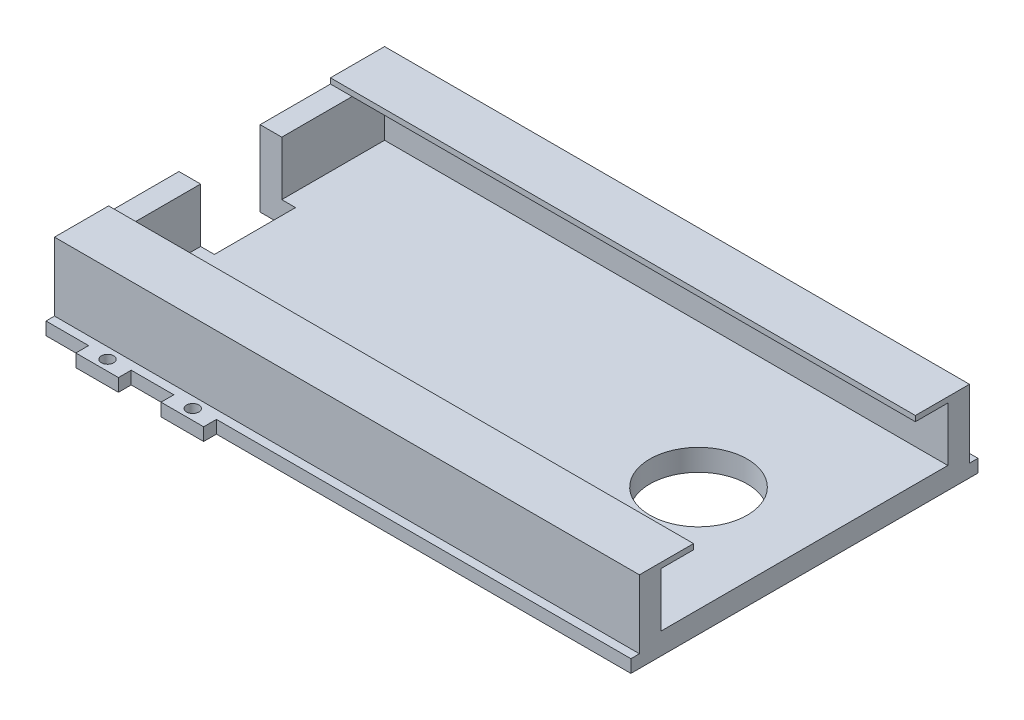
from build123d import *

# Parameters (mm, degrees)
SKETCH1_W           = 137.287
SKETCH1_H           = 77.47
BOSS_EXTRUDE1_DEPTH = 17.78
SKETCH2_W           = 132.207
SKETCH2_H           = 67.31
CUT_EXTRUDE1_DEPTH  = 12.7
SKETCH4_R           = 11.43
CUT_EXTRUDE2_DEPTH  = 80.834956737
SKETCH5_W           = 137.287
SKETCH5_H           = 12.7
BOSS_EXTRUDE2_DEPTH = 1.27
SKETCH6_W           = 8.314266468
SKETCH6_H           = 19.05
CUT_EXTRUDE3_DEPTH  = 81.798878193
SKETCH9_W           = 137.287
SKETCH9_H           = 2
SKETCH9_W_2         = 10
SKETCH9_H_2         = 3
BOSS_EXTRUDE4_DEPTH = 3
SKETCH10_R          = 1.44
CUT_EXTRUDE4_DEPTH  = 84.591762855


with BuildPart() as part:
    # Sketch1 → Boss-Extrude1 (new body)
    with BuildSketch(Plane(origin=(0, 0, 0), x_dir=(1, 0, 0), z_dir=(0, 1, 0))):
        Rectangle(SKETCH1_W, SKETCH1_H)
    extrude(amount=BOSS_EXTRUDE1_DEPTH)

    # Sketch2 → Cut-Extrude1 (cut)
    with BuildSketch(Plane(origin=(0, 17.78, 0), x_dir=(1, 0, 0), z_dir=(0, 1, 0))):
        with Locations((2.54, 0)):
            Rectangle(SKETCH2_W, SKETCH2_H)
    extrude(amount=-CUT_EXTRUDE1_DEPTH, mode=Mode.SUBTRACT)

    # Sketch4 → Cut-Extrude2 (cut, through all)
    with BuildSketch(Plane(origin=(0, 5.08, 0), x_dir=(1, 0, 0), z_dir=(0, 1, 0))):
        with Locations(Location((43.7769, 0, 0), (0, 0, 270))):
            Circle(SKETCH4_R)
    extrude(amount=-CUT_EXTRUDE2_DEPTH, mode=Mode.SUBTRACT)

    # Sketch5 → Boss-Extrude2 (add)
    with BuildSketch(Plane(origin=(0, 17.78, 0), x_dir=(1, 0, 0), z_dir=(0, 1, 0))):
        with Locations((0, 32.385)):
            Rectangle(SKETCH5_W, SKETCH5_H)
        with Locations((0, -32.385)):
            Rectangle(SKETCH5_W, SKETCH5_H)
    extrude(amount=BOSS_EXTRUDE2_DEPTH)

    # Sketch6 → Cut-Extrude3 (cut, through all)
    with BuildSketch(Plane(origin=(0, 17.78, 0), x_dir=(1, 0, 0), z_dir=(0, 1, 0))):
        with Locations((-64.486366766, 0)):
            Rectangle(SKETCH6_W, SKETCH6_H)
    extrude(amount=-CUT_EXTRUDE3_DEPTH, mode=Mode.SUBTRACT)

    # Sketch9 → Boss-Extrude4 (add)
    with BuildSketch(Plane(origin=(0, 0, 0), x_dir=(-1, 0, 0), z_dir=(0, -1, 0))):
        with Locations((0, -39.735)):
            Rectangle(SKETCH9_W, SKETCH9_H)
        with Locations((0, 39.735)):
            Rectangle(SKETCH9_W, SKETCH9_H)
        with Locations((53.6435, -42.235)):
            Rectangle(SKETCH9_W_2, SKETCH9_H_2)
        with Locations((53.6435, 42.235)):
            Rectangle(SKETCH9_W_2, SKETCH9_H_2)
        with Locations((33.6435, -42.235)):
            Rectangle(SKETCH9_W_2, SKETCH9_H_2)
        with Locations((33.6435, 42.235)):
            Rectangle(SKETCH9_W_2, SKETCH9_H_2)
    extrude(amount=-BOSS_EXTRUDE4_DEPTH)

    # Sketch10 → Cut-Extrude4 (cut, through all)
    with BuildSketch(Plane(origin=(0, 0, 0), x_dir=(-1, 0, 0), z_dir=(0, -1, 0))):
        with Locations(Location((33.6435, -41.295, 0), (0, 0, 90))):
            Circle(SKETCH10_R)
        with Locations(Location((53.6435, -41.295, 0), (0, 0, 90))):
            Circle(SKETCH10_R)
        with Locations(Location((53.6435, 41.295, 0), (0, 0, 90))):
            Circle(SKETCH10_R)
        with Locations(Location((33.6435, 41.295, 0), (0, 0, 90))):
            Circle(SKETCH10_R)
    extrude(amount=-CUT_EXTRUDE4_DEPTH, mode=Mode.SUBTRACT)


solid = part.part
